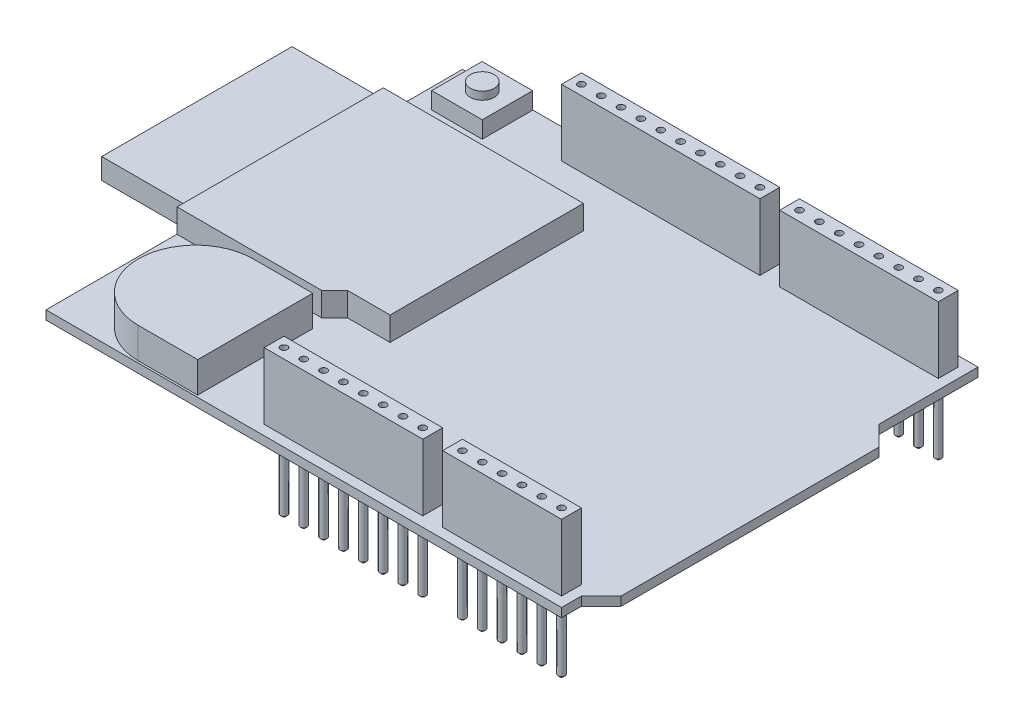
from build123d import *

# Parameters (mm, degrees)
BOSS_EXTRUDE1_DEPTH     = 1.143
SKETCH4_R               = 0.4445
BOSS_EXTRUDE2_DEPTH     = 10.16
BOSS_EXTRUDE3_START     = 8.509
SKETCH4_3_R             = 0.4445
SKETCH4_3_W             = 20.32
SKETCH4_3_H             = 2.54
SKETCH4_3_W_2           = 25.4
BOSS_EXTRUDE3_DEPTH     = 8.509
BOSS_EXTRUDE4_DEPTH     = 3.048
SKETCH6_W               = 26.416
SKETCH6_H               = 3.048
CUT_EXTRUDE1_DEPTH      = 0.0254
BOSS_EXTRUDE6_DEPTH     = 10.668
SKETCH8_W               = 6.477
SKETCH8_H               = 6.477
BOSS_EXTRUDE7_DEPTH     = 2.159
SKETCH9_R               = 1.524
BOSS_EXTRUDE9_DEPTH     = 1.016
BOSS_EXTRUDE10_DEPTH    = 3.937
CUT_EXTRUDE2_DEPTH      = 88.415863
CUT_EXTRUDE2_DEPTH_BACK = 0.0254
SKETCH11_W              = 6.477
SKETCH11_H              = 2.159
CHAMFER1_SIZE           = 0.254


with BuildPart() as part:
    # Sketch3 → Boss-Extrude1 (new body)
    with BuildSketch(Plane(origin=(0, 0, 0), x_dir=(1, 0, 0), z_dir=(0, 1, 0))):
        Polygon((0, 53.34), (0, 0), (66.04, 0), (66.04, 2.54), (68.58, 5.08), (68.58, 38.1), (66.04, 40.64), (66.04, 53.34), align=None)
    extrude(amount=BOSS_EXTRUDE1_DEPTH)

    # Sketch4 → Boss-Extrude2 (add)
    with BuildSketch(Plane(origin=(0, 1.143, 0), x_dir=(1, 0, 0), z_dir=(0, 1, 0))):
        with Locations((58.42, 2.54)):
            Circle(SKETCH4_R)
        with Locations((60.96, 2.54)):
            Circle(SKETCH4_R)
        with Locations((50.8, 2.54)):
            Circle(SKETCH4_R)
        with Locations((63.5, 2.54)):
            Circle(SKETCH4_R)
        with Locations((45.72, 2.54)):
            Circle(SKETCH4_R)
        with Locations((45.72, 50.8)):
            Circle(SKETCH4_R)
        with Locations((40.64, 50.8)):
            Circle(SKETCH4_R)
        with Locations((63.5, 50.8)):
            Circle(SKETCH4_R)
        with Locations((55.88, 2.54)):
            Circle(SKETCH4_R)
        with Locations((53.34, 2.54)):
            Circle(SKETCH4_R)
        with Locations((43.18, 2.54)):
            Circle(SKETCH4_R)
        with Locations((40.64, 2.54)):
            Circle(SKETCH4_R)
        with Locations((38.1, 2.54)):
            Circle(SKETCH4_R)
        with Locations((35.56, 2.54)):
            Circle(SKETCH4_R)
        with Locations((33.02, 2.54)):
            Circle(SKETCH4_R)
        with Locations((30.48, 2.54)):
            Circle(SKETCH4_R)
        with Locations((27.94, 2.54)):
            Circle(SKETCH4_R)
        with Locations((60.96, 50.8)):
            Circle(SKETCH4_R)
        with Locations((58.42, 50.8)):
            Circle(SKETCH4_R)
        with Locations((55.88, 50.8)):
            Circle(SKETCH4_R)
        with Locations((53.34, 50.8)):
            Circle(SKETCH4_R)
        with Locations((50.8, 50.8)):
            Circle(SKETCH4_R)
        with Locations((48.26, 50.8)):
            Circle(SKETCH4_R)
        with Locations((38.1, 50.8)):
            Circle(SKETCH4_R)
        with Locations((35.56, 50.8)):
            Circle(SKETCH4_R)
        with Locations((33.02, 50.8)):
            Circle(SKETCH4_R)
        with Locations((30.48, 50.8)):
            Circle(SKETCH4_R)
        with Locations((27.94, 50.8)):
            Circle(SKETCH4_R)
        with Locations((25.4, 50.8)):
            Circle(SKETCH4_R)
        with Locations((22.86, 50.8)):
            Circle(SKETCH4_R)
        with Locations((20.32, 50.8)):
            Circle(SKETCH4_R)
        with Locations((17.78, 50.8)):
            Circle(SKETCH4_R)
    extrude(amount=-BOSS_EXTRUDE2_DEPTH)

    # Sketch4<3> → Boss-Extrude3 (add)
    # profile 1 of 4: a face of its own
    with BuildSketch(Plane(origin=(0, 1.143, 0), x_dir=(1, 0, 0), z_dir=(0, 1, 0)).offset(BOSS_EXTRUDE3_START)):
        Polygon((49.53, 1.27), (64.77, 1.27), (64.77, 3.81), (49.53, 3.81), (49.53, 2.54), align=None)
        with Locations((63.5, 2.54)):
            Circle(SKETCH4_3_R, mode=Mode.SUBTRACT)
        with Locations((50.8, 2.54)):
            Circle(SKETCH4_3_R, mode=Mode.SUBTRACT)
        with Locations((53.34, 2.54)):
            Circle(SKETCH4_3_R, mode=Mode.SUBTRACT)
        with Locations((55.88, 2.54)):
            Circle(SKETCH4_3_R, mode=Mode.SUBTRACT)
        with Locations((58.42, 2.54)):
            Circle(SKETCH4_3_R, mode=Mode.SUBTRACT)
        with BuildLine():
            ThreePointArc((60.5155, 2.54), (60.96, 2.9845), (61.4045, 2.54))
            ThreePointArc((61.4045, 2.54), (60.96, 2.0955), (60.5155, 2.54))
        make_face(mode=Mode.SUBTRACT)
    # profile 2 of 4: a face of its own
    with BuildSketch(Plane(origin=(0, 1.143, 0), x_dir=(1, 0, 0), z_dir=(0, 1, 0)).offset(BOSS_EXTRUDE3_START)):
        with Locations((36.83, 2.54)):
            Rectangle(SKETCH4_3_W, SKETCH4_3_H)
        with Locations((45.72, 2.54)):
            Circle(SKETCH4_3_R, mode=Mode.SUBTRACT)
        with Locations((40.64, 2.54)):
            Circle(SKETCH4_3_R, mode=Mode.SUBTRACT)
        with Locations((43.18, 2.54)):
            Circle(SKETCH4_3_R, mode=Mode.SUBTRACT)
        with Locations((27.94, 2.54)):
            Circle(SKETCH4_3_R, mode=Mode.SUBTRACT)
        with Locations((30.48, 2.54)):
            Circle(SKETCH4_3_R, mode=Mode.SUBTRACT)
        with Locations((33.02, 2.54)):
            Circle(SKETCH4_3_R, mode=Mode.SUBTRACT)
        with Locations((35.56, 2.54)):
            Circle(SKETCH4_3_R, mode=Mode.SUBTRACT)
        with Locations((38.1, 2.54)):
            Circle(SKETCH4_3_R, mode=Mode.SUBTRACT)
    # profile 3 of 4: a face of its own
    with BuildSketch(Plane(origin=(0, 1.143, 0), x_dir=(1, 0, 0), z_dir=(0, 1, 0)).offset(BOSS_EXTRUDE3_START)):
        with Locations((29.21, 50.8)):
            Rectangle(SKETCH4_3_W_2, SKETCH4_3_H)
        with Locations((40.64, 50.8)):
            Circle(SKETCH4_3_R, mode=Mode.SUBTRACT)
        with Locations((17.78, 50.8)):
            Circle(SKETCH4_3_R, mode=Mode.SUBTRACT)
        with Locations((20.32, 50.8)):
            Circle(SKETCH4_3_R, mode=Mode.SUBTRACT)
        with Locations((22.86, 50.8)):
            Circle(SKETCH4_3_R, mode=Mode.SUBTRACT)
        with Locations((25.4, 50.8)):
            Circle(SKETCH4_3_R, mode=Mode.SUBTRACT)
        with Locations((27.94, 50.8)):
            Circle(SKETCH4_3_R, mode=Mode.SUBTRACT)
        with Locations((30.48, 50.8)):
            Circle(SKETCH4_3_R, mode=Mode.SUBTRACT)
        with Locations((33.02, 50.8)):
            Circle(SKETCH4_3_R, mode=Mode.SUBTRACT)
        with Locations((35.56, 50.8)):
            Circle(SKETCH4_3_R, mode=Mode.SUBTRACT)
        with Locations((38.1, 50.8)):
            Circle(SKETCH4_3_R, mode=Mode.SUBTRACT)
    # profile 4 of 4: a face of its own
    with BuildSketch(Plane(origin=(0, 1.143, 0), x_dir=(1, 0, 0), z_dir=(0, 1, 0)).offset(BOSS_EXTRUDE3_START)):
        Polygon((44.45, 52.07), (44.45, 50.8), (44.45, 49.53), (64.77, 49.53), (64.77, 52.07), align=None)
        with Locations((63.5, 50.8)):
            Circle(SKETCH4_3_R, mode=Mode.SUBTRACT)
        with Locations((45.72, 50.8)):
            Circle(SKETCH4_3_R, mode=Mode.SUBTRACT)
        with Locations((48.26, 50.8)):
            Circle(SKETCH4_3_R, mode=Mode.SUBTRACT)
        with Locations((50.8, 50.8)):
            Circle(SKETCH4_3_R, mode=Mode.SUBTRACT)
        with Locations((53.34, 50.8)):
            Circle(SKETCH4_3_R, mode=Mode.SUBTRACT)
        with Locations((55.88, 50.8)):
            Circle(SKETCH4_3_R, mode=Mode.SUBTRACT)
        with Locations((58.42, 50.8)):
            Circle(SKETCH4_3_R, mode=Mode.SUBTRACT)
        with Locations((60.96, 50.8)):
            Circle(SKETCH4_3_R, mode=Mode.SUBTRACT)
    extrude(amount=-BOSS_EXTRUDE3_DEPTH)

    # Sketch5 → Boss-Extrude4 (add)
    with BuildSketch(Plane(origin=(0, 1.143, 0), x_dir=(1, 0, 0), z_dir=(0, 1, 0))):
        Polygon((0, 43.18), (0, 16.764), (18.542, 16.764), (20.193, 18.415), (25.654, 18.415), (25.654, 43.18), align=None)
    extrude(amount=BOSS_EXTRUDE4_DEPTH)

    # Sketch6 → Cut-Extrude1 (cut)
    with BuildSketch(Plane.ZY):
        with Locations((-29.972, 2.667)):
            Rectangle(SKETCH6_W, SKETCH6_H)
    extrude(amount=-CUT_EXTRUDE1_DEPTH, mode=Mode.SUBTRACT)

    # Sketch7 → Boss-Extrude6 (add)
    with BuildSketch(Plane.ZY.offset(-0.0254)):
        Polygon((-42.164, 3.937), (-42.164, 1.27), (-17.78, 1.27), (-17.78, 3.937), (-17.885282802, 3.937), align=None)
    extrude(amount=BOSS_EXTRUDE6_DEPTH)

    # Sketch8 → Boss-Extrude7 (add)
    with BuildSketch(Plane(origin=(0, 1.143, 0), x_dir=(1, 0, 0), z_dir=(0, 1, 0))):
        with Locations((5.7785, 50.1015)):
            Rectangle(SKETCH8_W, SKETCH8_H)
    extrude(amount=BOSS_EXTRUDE7_DEPTH)

    # Sketch9 → Boss-Extrude9 (add)
    with BuildSketch(Plane(origin=(0, 3.302, 0), x_dir=(1, 0, 0), z_dir=(0, 1, 0))):
        with Locations((5.7785, 50.1015)):
            Circle(SKETCH9_R)
    extrude(amount=BOSS_EXTRUDE9_DEPTH)

    # Sketch10 → Boss-Extrude10 (add)
    with BuildSketch(Plane(origin=(0, 1.143, 0), x_dir=(1, 0, 0), z_dir=(0, 1, 0))):
        with BuildLine():
            Line((19.177, 14.986), (11.557, 14.986))
            ThreePointArc((11.557, 14.986), (6.34845145, 12.82854855), (4.191, 7.62))
            ThreePointArc((4.191, 7.62), (6.34845145, 2.41145145), (11.557, 0.254))
            Line((11.557, 0.254), (19.177, 0.254))
            Line((19.177, 0.254), (19.177, 14.986))
        make_face()
    extrude(amount=BOSS_EXTRUDE10_DEPTH)

    # Sketch11 → Cut-Extrude2 (cut, two sides: drawn at the far end of the back side and taken through both)
    with BuildSketch(Plane(origin=(0, 0, -53.34), x_dir=(-1, 0, 0), z_dir=(0, 0, -1)).offset(-CUT_EXTRUDE2_DEPTH_BACK)):
        with Locations((-5.7785, 2.2225)):
            Rectangle(SKETCH11_W, SKETCH11_H)
    extrude(amount=CUT_EXTRUDE2_DEPTH + CUT_EXTRUDE2_DEPTH_BACK, mode=Mode.SUBTRACT)

    # Chamfer1
    chamfer1_edges = [part.edges().sort_by_distance(p)[0] for p in [
        (30.0355, 0, -50.8),
        (30.0355, -9.017, -50.8),
        (32.5755, 0, -50.8),
        (32.5755, -9.017, -50.8),
        (35.1155, 0, -50.8),
        (35.1155, -9.017, -50.8),
        (37.6555, 0, -50.8),
        (37.6555, -9.017, -50.8),
        (40.1955, 0, -50.8),
        (40.1955, -9.017, -50.8),
        (45.2755, 0, -50.8),
        (45.2755, -9.017, -50.8),
        (47.8155, 0, -50.8),
        (47.8155, -9.017, -50.8),
        (50.3555, 0, -50.8),
        (50.3555, -9.017, -50.8),
        (52.8955, 0, -50.8),
        (52.8955, -9.017, -50.8),
        (55.4355, 0, -50.8),
        (55.4355, -9.017, -50.8),
        (57.9755, 0, -50.8),
        (57.9755, -9.017, -50.8),
        (60.5155, 0, -50.8),
        (60.5155, -9.017, -50.8),
        (63.0555, 0, -50.8),
        (63.0555, -9.017, -50.8),
        (27.4955, 0, -50.8),
        (27.4955, -9.017, -50.8),
        (24.9555, 0, -50.8),
        (24.9555, -9.017, -50.8),
        (22.4155, 0, -50.8),
        (22.4155, -9.017, -50.8),
        (19.8755, 0, -50.8),
        (19.8755, -9.017, -50.8),
        (17.3355, 0, -50.8),
        (17.3355, -9.017, -50.8),
        (27.4955, 0, -2.54),
        (27.4955, -9.017, -2.54),
        (30.0355, 0, -2.54),
        (30.0355, -9.017, -2.54),
        (32.5755, 0, -2.54),
        (32.5755, -9.017, -2.54),
        (35.1155, 0, -2.54),
        (35.1155, -9.017, -2.54),
        (37.6555, 0, -2.54),
        (37.6555, -9.017, -2.54),
        (40.1955, 0, -2.54),
        (40.1955, -9.017, -2.54),
        (42.7355, 0, -2.54),
        (42.7355, -9.017, -2.54),
        (45.2755, 0, -2.54),
        (45.2755, -9.017, -2.54),
        (50.3555, 0, -2.54),
        (50.3555, -9.017, -2.54),
        (52.8955, 0, -2.54),
        (52.8955, -9.017, -2.54),
        (55.4355, 0, -2.54),
        (55.4355, -9.017, -2.54),
        (57.9755, 0, -2.54),
        (57.9755, -9.017, -2.54),
        (60.5155, 0, -2.54),
        (60.5155, -9.017, -2.54),
        (63.0555, 0, -2.54),
        (63.0555, -9.017, -2.54),
    ]]
    chamfer(chamfer1_edges, length=CHAMFER1_SIZE)


solid = part.part
